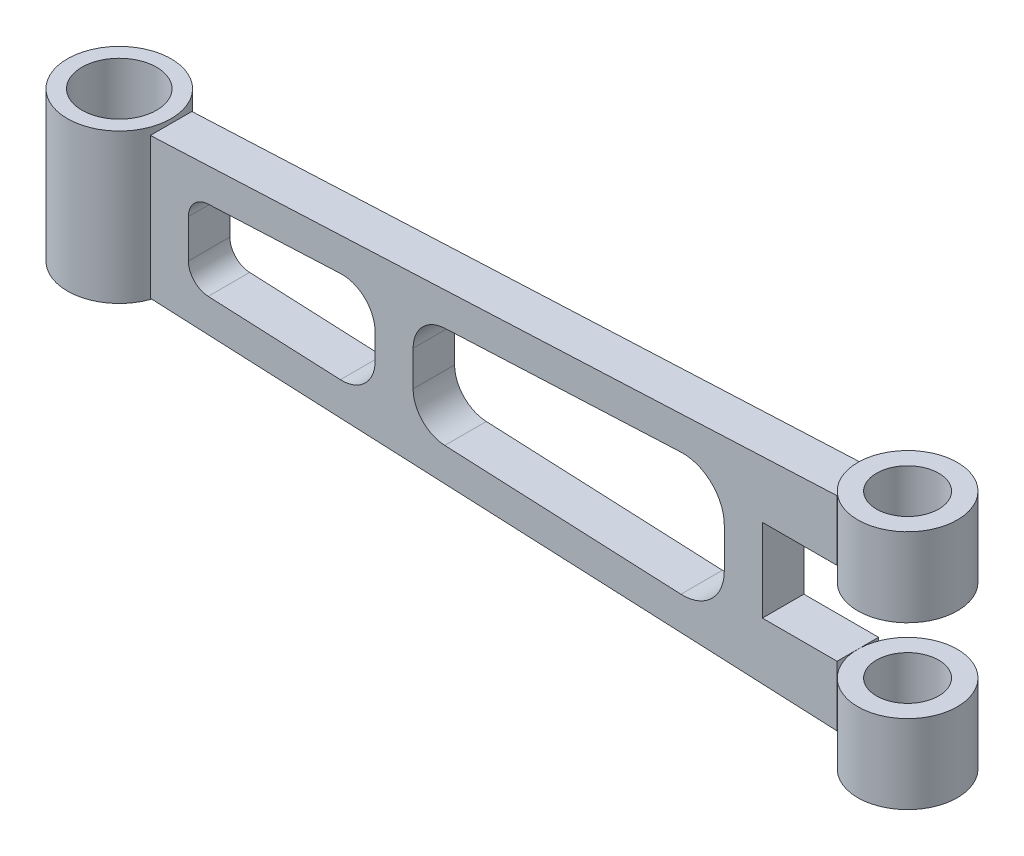
from build123d import *

# Parameters (mm, degrees)
BOSS_EXTRUDE1_DEPTH = 10
SKETCH2_R           = 12.5
SKETCH2_R_2         = 9
BOSS_EXTRUDE2_DEPTH = 18
SKETCH3_R           = 12
SKETCH3_R_2         = 7.5
BOSS_EXTRUDE3_DEPTH = 19


with BuildPart() as part:
    # Sketch1 → Boss-Extrude1 (new body)
    with BuildSketch(Plane.XY):
        Polygon((165.5, -24.552818182), (0, -17), (0, 17), (165.5, 24.552818182), (165.5, 10), (147.5, 10), (147.5, -10), (165.5, -10), align=None)
        with BuildLine():
            ThreePointArc((138.32, 4.837323832), (135.228006533, 12.067776497), (127.864110852, 14.826926681))
            Line((127.864110852, 14.826926681), (70.955288681, 12.229814978))
            ThreePointArc((70.955288681, 12.229814978), (65.535637868, 9.764537925), (63.32, 4.238132699))
            Line((63.32, 4.238132699), (63.32, -4.238132699))
            ThreePointArc((63.32, -4.238132699), (65.535637868, -9.764537925), (70.955288681, -12.229814978))
            Line((70.955288681, -12.229814978), (127.864110852, -14.826926681))
            ThreePointArc((127.864110852, -14.826926681), (135.228006533, -12.067776497), (138.32, -4.837323832))
            Line((138.32, -4.837323832), (138.32, 4.837323832))
        make_face(mode=Mode.SUBTRACT)
        with BuildLine():
            Line((9.16, 0), (9.16, 4.632680545))
            ThreePointArc((9.16, 4.632680545), (10.544773667, 8.086683812), (13.932055426, 9.62748197))
            Line((13.932055426, 9.62748197), (45.795288681, 11.081604069))
            ThreePointArc((45.795288681, 11.081604069), (51.686405226, 8.874283922), (54.16, 3.08992179))
            Line((54.16, 3.08992179), (54.16, -3.08992179))
            ThreePointArc((54.16, -3.08992179), (51.686405226, -8.874283922), (45.795288681, -11.081604069))
            Line((45.795288681, -11.081604069), (13.932055426, -9.62748197))
            ThreePointArc((13.932055426, -9.62748197), (10.544773667, -8.086683812), (9.16, -4.632680545))
            Line((9.16, -4.632680545), (9.16, 0))
        make_face(mode=Mode.SUBTRACT)
    extrude(amount=-BOSS_EXTRUDE1_DEPTH)


with BuildPart() as body_2:
    # Sketch2 → Boss-Extrude2 (new, symmetric)
    with BuildSketch(Plane(origin=(0, 0, 0), x_dir=(1, 0, 0), z_dir=(0, 1, 0))):
        with Locations(Location((-12.5, 5, 0), (0, 0, 270))):
            Circle(SKETCH2_R)
        with Locations(Location((-12.5, 5, 0), (0, 0, 270))):
            Circle(SKETCH2_R_2, mode=Mode.SUBTRACT)
    extrude(amount=BOSS_EXTRUDE2_DEPTH, both=True)


with BuildPart() as body_3:
    # Sketch3 → Boss-Extrude3 (new body)
    with BuildSketch(Plane(origin=(0, -10, 0), x_dir=(1, 0, 0), z_dir=(0, 1, 0))):
        with Locations(Location((177.5, 5, 0), (0, 0, 270))):
            Circle(SKETCH3_R)
        with Locations(Location((177.5, 5, 0), (0, 0, 270))):
            Circle(SKETCH3_R_2, mode=Mode.SUBTRACT)
    extrude(amount=-BOSS_EXTRUDE3_DEPTH)


with BuildPart() as body_4:
    # Mirror2: mirrored copy
    add(body_3.part.mirror(Plane.ZX))


solid = Compound([part.part, body_2.part, body_3.part, body_4.part])
